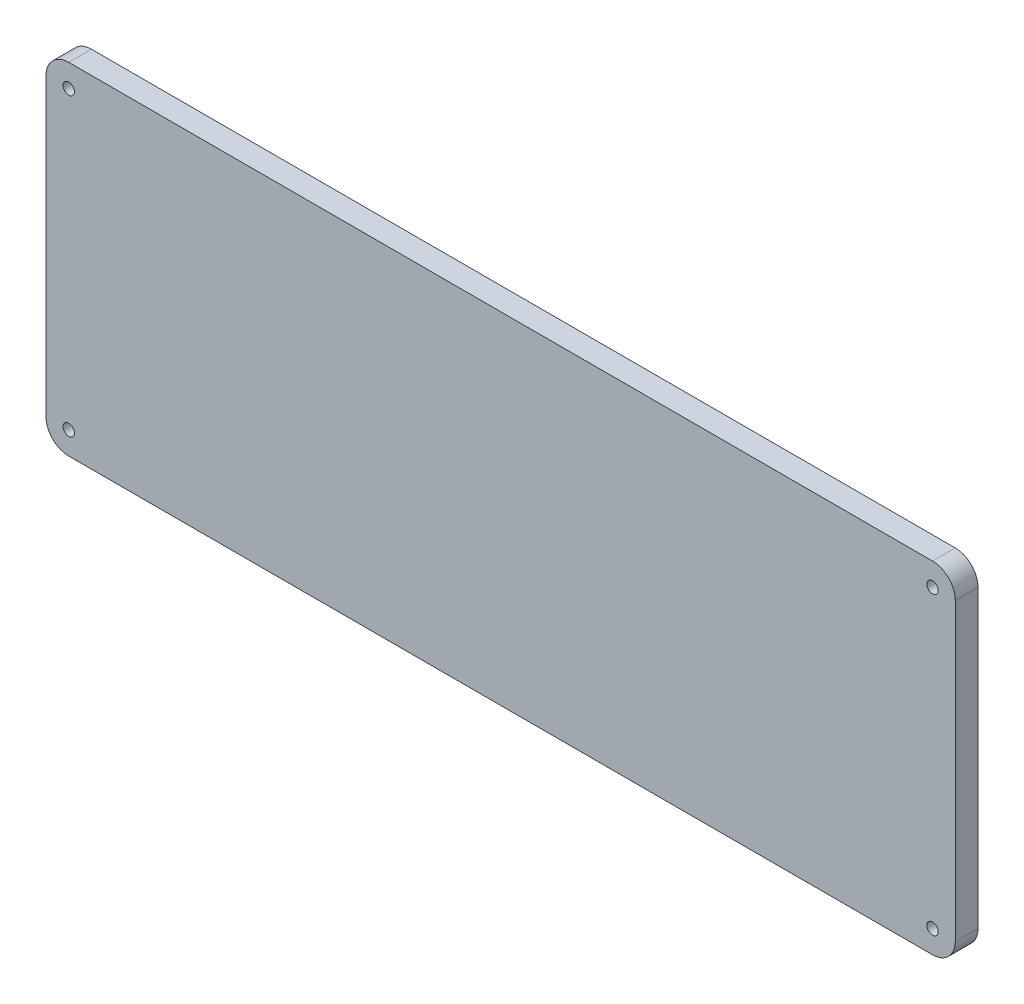
from build123d import *

# Parameters (mm, degrees)
SKETCH1_R           = 2.5
BOSS_EXTRUDE1_DEPTH = 10


with BuildPart() as part:
    # Sketch1 → Boss-Extrude1 (new body)
    with BuildSketch(Plane.XY):
        with BuildLine():
            Line((-190, -75), (190, -75))
            ThreePointArc((190, -75), (197.071067812, -72.071067812), (200, -65))
            Line((200, -65), (200, 65))
            ThreePointArc((200, 65), (197.071067812, 72.071067812), (190, 75))
            Line((190, 75), (-190, 75))
            ThreePointArc((-190, 75), (-197.071067812, 72.071067812), (-200, 65))
            Line((-200, 65), (-200, -65))
            ThreePointArc((-200, -65), (-197.071067812, -72.071067812), (-190, -75))
        make_face()
        with Locations((-190, 65)):
            Circle(SKETCH1_R, mode=Mode.SUBTRACT)
        with Locations(Location((-190, -65, 0), (0, 0, 180))):
            Circle(SKETCH1_R, mode=Mode.SUBTRACT)
        with Locations((190, -65)):
            Circle(SKETCH1_R, mode=Mode.SUBTRACT)
        with Locations(Location((190, 65, 0), (0, 0, 180))):
            Circle(SKETCH1_R, mode=Mode.SUBTRACT)
    extrude(amount=BOSS_EXTRUDE1_DEPTH)


solid = part.part
